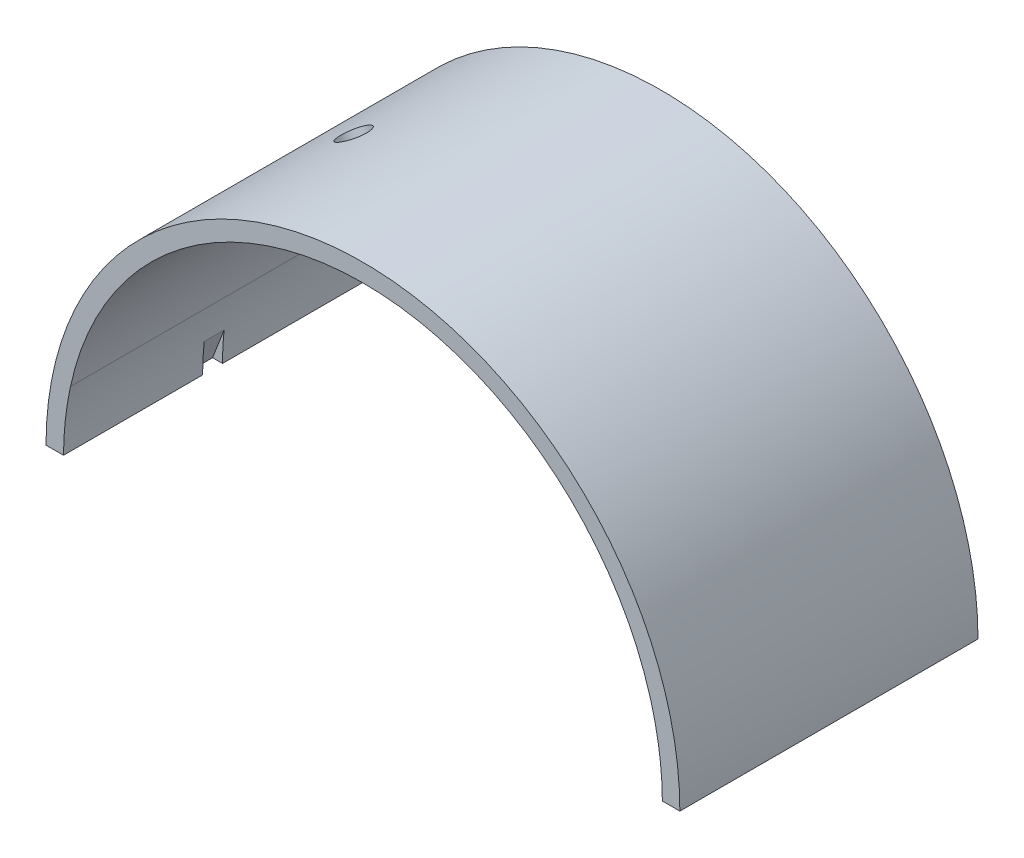
from build123d import *

# Parameters (mm, degrees)
BOSS_EXTRUDE1_DEPTH      = 15
BOSS_EXTRUDE2_DEPTH      = 15
SKETCH5_W                = 1
SKETCH5_H                = 2
SKETCH8_W                = 1
SKETCH8_H                = 2
F_3_0_3_DIAMETER_HOLE1_D = 3


with BuildPart() as part:
    # Sketch1 → Boss-Extrude1 (new, symmetric)
    with BuildSketch(Plane.XY):
        with BuildLine():
            Line((-31.891178344, 0), (-30.472178344, 0))
            ThreePointArc((-30.472178344, 0), (0, 30.472178344), (30.472178344, 0))
            Line((30.472178344, 0), (31.891178344, 0))
            ThreePointArc((31.891178344, 0), (0, 31.891178344), (-31.891178344, 0))
        make_face()
    extrude(amount=BOSS_EXTRUDE1_DEPTH, both=True)

    # Sketch2 → Boss-Extrude2 (add, symmetric)
    with BuildSketch(Plane.XY):
        with BuildLine():
            Line((-30.129278344, 0), (-30.472178344, 0))
            ThreePointArc((-30.472178344, 0), (0, 30.472178344), (30.472178344, 0))
            Line((30.472178344, 0), (30.129278344, 0))
            ThreePointArc((30.129278344, 0), (29.947091618, 3.193657531), (29.427339134, 6.35))
            add(Edge.make_bspline(
                [(29.427339134, 6.35), (24.299524612, 30.091178344), (0, 30.091178344), (-24.299524612, 30.091178344), (-29.427339134, 6.35)],
                knots=[0.212623764, 0.212623764, 0.212623764, 1.570796327, 1.570796327, 2.928968889, 2.928968889, 2.928968889], degree=2, weights=[1, 0.778146934, 1, 0.778146934, 1]))
            ThreePointArc((-29.427339134, 6.35), (-29.947091618, 3.193657531), (-30.129278344, 0))
        make_face()
    extrude(amount=BOSS_EXTRUDE2_DEPTH, both=True)

    # Sweep1: sweep along a path in Sketch6
    with BuildLine(Plane.XY) as sweep1_path:
        Line((-32.891178344, 0), (-31.749759939, 3))
    # Sketch5 → Sweep1 (sweep)
    with BuildSketch(Plane(origin=(0, 0, 0), x_dir=(1, 0, 0), z_dir=(0, 1, 0))):
        with Locations((-32.391178344, 0)):
            Rectangle(SKETCH5_W, SKETCH5_H)
    sweep(path=sweep1_path.line)

    # Cut-Sweep1: sweep along a path in Sketch9
    with BuildLine(Plane.XY) as cut_sweep1_path:
        Line((-31.129278344, 0), (-29.967865469, 3))
    # Sketch8 → Cut-Sweep1 (sweep, cut)
    with BuildSketch(Plane(origin=(0, 0, 0), x_dir=(1, 0, 0), z_dir=(0, 1, 0))):
        with Locations((-30.629278344, 0)):
            Rectangle(SKETCH8_W, SKETCH8_H)
    sweep(path=cut_sweep1_path.line, mode=Mode.SUBTRACT)

    # Ø3.0 (3) Diameter Hole1 (through all)
    with Locations(Plane(origin=(-15.945589172, 27.618570602, 0), x_dir=(0.866025403784, 0.5, 0), z_dir=(-0.5, 0.866025403784, 0))):
        with Locations((0, 0)):
            Hole(F_3_0_3_DIAMETER_HOLE1_D / 2)


solid = part.part
